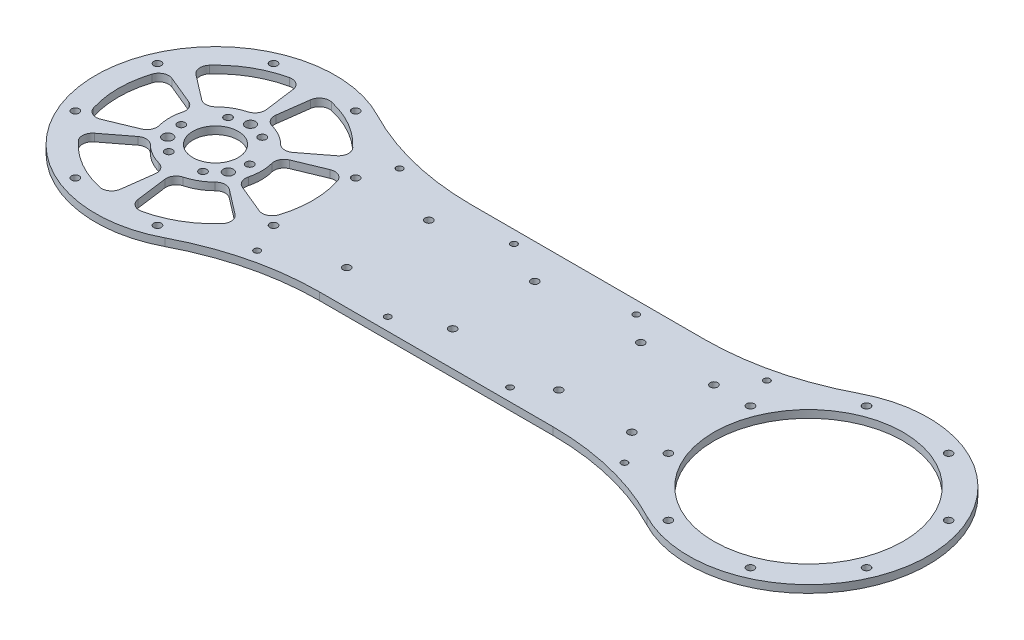
from build123d import *

# Parameters (mm, degrees)
SKETCH_1_R               = 1.5
SKETCH_1_R_2             = 37.5
SKETCH_1_R_3             = 9
SKETCH_1_R_4             = 2
EXTRUDE_1_DEPTH          = 3
SKETCH_2_R               = 1.25
CUT_EXTRUDE_1_DEPTH      = 10
CUT_EXTRUDE_2_DEPTH      = 10
CUT_EXTRUDE_3_DEPTH      = 287.481238478
CUT_EXTRUDE_3_DEPTH_BACK = 287.481238478
SKETCH_4_R               = 1.5


with BuildPart() as part:
    # 草图1 → 凸台-拉伸1 (new body)
    with BuildSketch(Plane(origin=(0, 0, 0), x_dir=(1, 0, 0), z_dir=(0, 1, 0))):
        with BuildLine():
            Line((71.271215686, 30), (163.728784314, 30))
            ThreePointArc((163.728784314, 30), (189.096168452, 33.068787794), (213, 42.09809972))
            ThreePointArc((213, 42.09809972), (282.5, 0), (213, -42.09809972))
            ThreePointArc((213, -42.09809972), (189.096168452, -33.068787794), (163.728784314, -30))
            Line((163.728784314, -30), (71.271215686, -30))
            ThreePointArc((71.271215686, -30), (45.903831548, -33.068787794), (22, -42.09809972))
            ThreePointArc((22, -42.09809972), (-47.5, 0), (22, 42.09809972))
            ThreePointArc((22, 42.09809972), (45.903831548, 33.068787794), (71.271215686, 30))
        make_face()
        with Locations(Location((218.735954124, 39.264880132, 0), (0, 0, 270))):
            Circle(SKETCH_1_R, mode=Mode.SUBTRACT)
        with Locations(Location((251.264045876, 39.264880132, 0), (0, 0, 270))):
            Circle(SKETCH_1_R, mode=Mode.SUBTRACT)
        with Locations(Location((274.264880132, 16.264045876, 0), (0, 0, 270))):
            Circle(SKETCH_1_R, mode=Mode.SUBTRACT)
        with Locations(Location((274.264880132, -16.264045876, 0), (0, 0, 270))):
            Circle(SKETCH_1_R, mode=Mode.SUBTRACT)
        with Locations(Location((251.264045876, -39.264880132, 0), (0, 0, 270))):
            Circle(SKETCH_1_R, mode=Mode.SUBTRACT)
        with Locations(Location((218.735954124, -39.264880132, 0), (0, 0, 270))):
            Circle(SKETCH_1_R, mode=Mode.SUBTRACT)
        with Locations(Location((195.735119868, -16.264045876, 0), (0, 0, 270))):
            Circle(SKETCH_1_R, mode=Mode.SUBTRACT)
        with Locations(Location((195.735119868, 16.264045876, 0), (0, 0, 270))):
            Circle(SKETCH_1_R, mode=Mode.SUBTRACT)
        with Locations(Location((235, 0, 0), (0, 0, 270))):
            Circle(SKETCH_1_R_2, mode=Mode.SUBTRACT)
        with Locations(Location((-16.264045876, 39.264880132, 0), (0, 0, 270))):
            Circle(SKETCH_1_R, mode=Mode.SUBTRACT)
        with Locations(Location((16.264045876, 39.264880132, 0), (0, 0, 270))):
            Circle(SKETCH_1_R, mode=Mode.SUBTRACT)
        with Locations(Location((39.264880132, 16.264045876, 0), (0, 0, 270))):
            Circle(SKETCH_1_R, mode=Mode.SUBTRACT)
        with Locations(Location((39.264880132, -16.264045876, 0), (0, 0, 270))):
            Circle(SKETCH_1_R, mode=Mode.SUBTRACT)
        with Locations(Location((16.264045876, -39.264880132, 0), (0, 0, 270))):
            Circle(SKETCH_1_R, mode=Mode.SUBTRACT)
        with Locations(Location((-16.264045876, -39.264880132, 0), (0, 0, 270))):
            Circle(SKETCH_1_R, mode=Mode.SUBTRACT)
        with Locations(Location((-39.264880132, -16.264045876, 0), (0, 0, 270))):
            Circle(SKETCH_1_R, mode=Mode.SUBTRACT)
        with Locations(Location((-39.264880132, 16.264045876, 0), (0, 0, 270))):
            Circle(SKETCH_1_R, mode=Mode.SUBTRACT)
        with Locations(Location((0, 0, 0), (0, 0, 270))):
            Circle(SKETCH_1_R_3, mode=Mode.SUBTRACT)
        with Locations(Location((-6.783865663, 11.75, 0), (0, 0, 270))):
            Circle(SKETCH_1_R, mode=Mode.SUBTRACT)
        with Locations(Location((6.783865663, 11.75, 0), (0, 0, 270))):
            Circle(SKETCH_1_R, mode=Mode.SUBTRACT)
        with Locations(Location((13.567731326, 0, 0), (0, 0, 270))):
            Circle(SKETCH_1_R, mode=Mode.SUBTRACT)
        with Locations(Location((6.783865663, -11.75, 0), (0, 0, 270))):
            Circle(SKETCH_1_R, mode=Mode.SUBTRACT)
        with Locations(Location((-6.783865663, -11.75, 0), (0, 0, 270))):
            Circle(SKETCH_1_R, mode=Mode.SUBTRACT)
        with Locations(Location((-13.567731326, 0, 0), (0, 0, 270))):
            Circle(SKETCH_1_R, mode=Mode.SUBTRACT)
        with Locations(Location((0, 13.856406461, 0), (0, 0, 270))):
            Circle(SKETCH_1_R_4, mode=Mode.SUBTRACT)
        with Locations(Location((-12, -6.92820323, 0), (0, 0, 270))):
            Circle(SKETCH_1_R_4, mode=Mode.SUBTRACT)
        with Locations(Location((12, -6.92820323, 0), (0, 0, 270))):
            Circle(SKETCH_1_R_4, mode=Mode.SUBTRACT)
    extrude(amount=EXTRUDE_1_DEPTH)

    # 草图2 → 切除-拉伸1 (cut)
    with BuildSketch(Plane.XZ):
        with Locations(Location((190.288457303, 28.213023457, 0), (0, 0, 270))):
            Circle(SKETCH_2_R)
        with Locations(Location((141.728784314, 25, 0), (0, 0, 270))):
            Circle(SKETCH_2_R)
        with Locations(Location((93.271215686, 25, 0), (0, 0, 270))):
            Circle(SKETCH_2_R)
        with Locations(Location((44.711542697, 28.213023457, 0), (0, 0, 270))):
            Circle(SKETCH_2_R)
        with Locations(Location((44.711542697, -28.213023457, 0), (0, 0, 270))):
            Circle(SKETCH_2_R)
        with Locations(Location((93.271215686, -25, 0), (0, 0, 270))):
            Circle(SKETCH_2_R)
        with Locations(Location((141.728784314, -25, 0), (0, 0, 270))):
            Circle(SKETCH_2_R)
        with Locations(Location((190.288457303, -28.213023457, 0), (0, 0, 270.000000002))):
            Circle(SKETCH_2_R)
    extrude(amount=-CUT_EXTRUDE_1_DEPTH, mode=Mode.SUBTRACT)

    # 草图3 → 切除-拉伸2 (cut)
    with BuildSketch(Plane.XZ):
        with BuildLine():
            Line((3.494651309, 34.205809627), (1.886243278, 21.988737715))
            ThreePointArc((1.886243278, 21.988737715), (2.52132569, 19.251580515), (4.799973695, 17.607462978))
            ThreePointArc((4.799973695, 17.607462978), (9.125, 15.804963619), (12.848523388, 12.960630646))
            ThreePointArc((12.848523388, 12.960630646), (15.411694944, 11.809322357), (18.099683819, 12.627903454))
            Line((18.099683819, 12.627903454), (27.875774439, 20.129361624))
            ThreePointArc((27.875774439, 20.129361624), (29.425472637, 22.953753578), (28.390378431, 26.004545998))
            ThreePointArc((28.390378431, 26.004545998), (19.25, 33.341978046), (8.325408233, 37.589061943))
            ThreePointArc((8.325408233, 37.589061943), (5.165797392, 36.960083611), (3.494651309, 34.205809627))
        make_face()
        with BuildLine():
            Line((31.370425748, 14.076448003), (19.985927097, 9.360834261))
            ThreePointArc((19.985927097, 9.360834261), (17.933020634, 7.442258159), (17.648497083, 4.646832332))
            ThreePointArc((17.648497083, 4.646832332), (18.25, 0), (17.648497083, -4.646832332))
            ThreePointArc((17.648497083, -4.646832332), (17.933020634, -7.442258159), (19.985927097, -9.360834261))
            Line((19.985927097, -9.360834261), (31.370425748, -14.076448003))
            ThreePointArc((31.370425748, -14.076448003), (34.591270029, -14.006330033), (36.715786664, -11.584515945))
            ThreePointArc((36.715786664, -11.584515945), (38.5, 0), (36.715786664, 11.584515945))
            ThreePointArc((36.715786664, 11.584515945), (34.591270029, 14.006330033), (31.370425748, 14.076448003))
        make_face()
        with BuildLine():
            Line((27.875774439, -20.129361624), (18.099683819, -12.627903454))
            ThreePointArc((18.099683819, -12.627903454), (15.411694944, -11.809322357), (12.848523388, -12.960630646))
            ThreePointArc((12.848523388, -12.960630646), (9.125, -15.804963619), (4.799973695, -17.607462978))
            ThreePointArc((4.799973695, -17.607462978), (2.52132569, -19.251580515), (1.886243278, -21.988737715))
            Line((1.886243278, -21.988737715), (3.494651309, -34.205809627))
            ThreePointArc((3.494651309, -34.205809627), (5.165797392, -36.960083611), (8.325408233, -37.589061943))
            ThreePointArc((8.325408233, -37.589061943), (19.25, -33.341978046), (28.390378431, -26.004545998))
            ThreePointArc((28.390378431, -26.004545998), (29.425472637, -22.953753578), (27.875774439, -20.129361624))
        make_face()
        with BuildLine():
            Line((-3.494651309, -34.205809627), (-1.886243278, -21.988737715))
            ThreePointArc((-1.886243278, -21.988737715), (-2.52132569, -19.251580515), (-4.799973695, -17.607462978))
            ThreePointArc((-4.799973695, -17.607462978), (-9.125, -15.804963619), (-12.848523388, -12.960630646))
            ThreePointArc((-12.848523388, -12.960630646), (-15.411694944, -11.809322357), (-18.099683819, -12.627903454))
            Line((-18.099683819, -12.627903454), (-27.875774439, -20.129361624))
            ThreePointArc((-27.875774439, -20.129361624), (-29.425472637, -22.953753578), (-28.390378431, -26.004545998))
            ThreePointArc((-28.390378431, -26.004545998), (-19.25, -33.341978046), (-8.325408233, -37.589061943))
            ThreePointArc((-8.325408233, -37.589061943), (-5.165797392, -36.960083611), (-3.494651309, -34.205809627))
        make_face()
        with BuildLine():
            Line((-31.370425748, -14.076448003), (-19.985927097, -9.360834261))
            ThreePointArc((-19.985927097, -9.360834261), (-17.933020634, -7.442258159), (-17.648497083, -4.646832332))
            ThreePointArc((-17.648497083, -4.646832332), (-18.25, 0), (-17.648497083, 4.646832332))
            ThreePointArc((-17.648497083, 4.646832332), (-17.933020634, 7.442258159), (-19.985927097, 9.360834261))
            Line((-19.985927097, 9.360834261), (-31.370425748, 14.076448003))
            ThreePointArc((-31.370425748, 14.076448003), (-34.591270029, 14.006330033), (-36.715786664, 11.584515945))
            ThreePointArc((-36.715786664, 11.584515945), (-38.5, 0), (-36.715786664, -11.584515945))
            ThreePointArc((-36.715786664, -11.584515945), (-34.591270029, -14.006330033), (-31.370425748, -14.076448003))
        make_face()
        with BuildLine():
            Line((-27.875774439, 20.129361624), (-18.099683819, 12.627903454))
            ThreePointArc((-18.099683819, 12.627903454), (-15.411694944, 11.809322357), (-12.848523388, 12.960630646))
            ThreePointArc((-12.848523388, 12.960630646), (-9.125, 15.804963619), (-4.799973695, 17.607462978))
            ThreePointArc((-4.799973695, 17.607462978), (-2.52132569, 19.251580515), (-1.886243278, 21.988737715))
            Line((-1.886243278, 21.988737715), (-3.494651309, 34.205809627))
            ThreePointArc((-3.494651309, 34.205809627), (-5.165797392, 36.960083611), (-8.325408233, 37.589061943))
            ThreePointArc((-8.325408233, 37.589061943), (-19.25, 33.341978046), (-28.390378431, 26.004545998))
            ThreePointArc((-28.390378431, 26.004545998), (-29.425472637, 22.953753578), (-27.875774439, 20.129361624))
        make_face()
    extrude(amount=-CUT_EXTRUDE_2_DEPTH, mode=Mode.SUBTRACT)

    # 草图4 → 切除-拉伸3 (cut, two sides: drawn at the far end of the back side and taken through both)
    with BuildSketch(Plane(origin=(0, 3, 0), x_dir=(1, 0, 0), z_dir=(0, 1, 0)).offset(-CUT_EXTRUDE_3_DEPTH_BACK)):
        with Locations(Location((68.264880132, -16.264045876, 0), (0, 0, 270))):
            Circle(SKETCH_4_R)
        with Locations(Location((110.264880132, -16.264045876, 0), (0, 0, 270))):
            Circle(SKETCH_4_R)
        with Locations(Location((181.264880132, -16.264045876, 0), (0, 0, 270))):
            Circle(SKETCH_4_R)
        with Locations(Location((152.264880132, -16.264045876, 0), (0, 0, 270))):
            Circle(SKETCH_4_R)
        with Locations(Location((181.264880132, 16.264045876, 0), (0, 0, 270))):
            Circle(SKETCH_4_R)
        with Locations(Location((152.264880132, 16.264045876, 0), (0, 0, 270))):
            Circle(SKETCH_4_R)
        with Locations(Location((110.264880132, 16.264045876, 0), (0, 0, 270))):
            Circle(SKETCH_4_R)
        with Locations(Location((68.264880132, 16.264045876, 0), (0, 0, 270))):
            Circle(SKETCH_4_R)
    extrude(amount=CUT_EXTRUDE_3_DEPTH + CUT_EXTRUDE_3_DEPTH_BACK, mode=Mode.SUBTRACT)


solid = part.part
